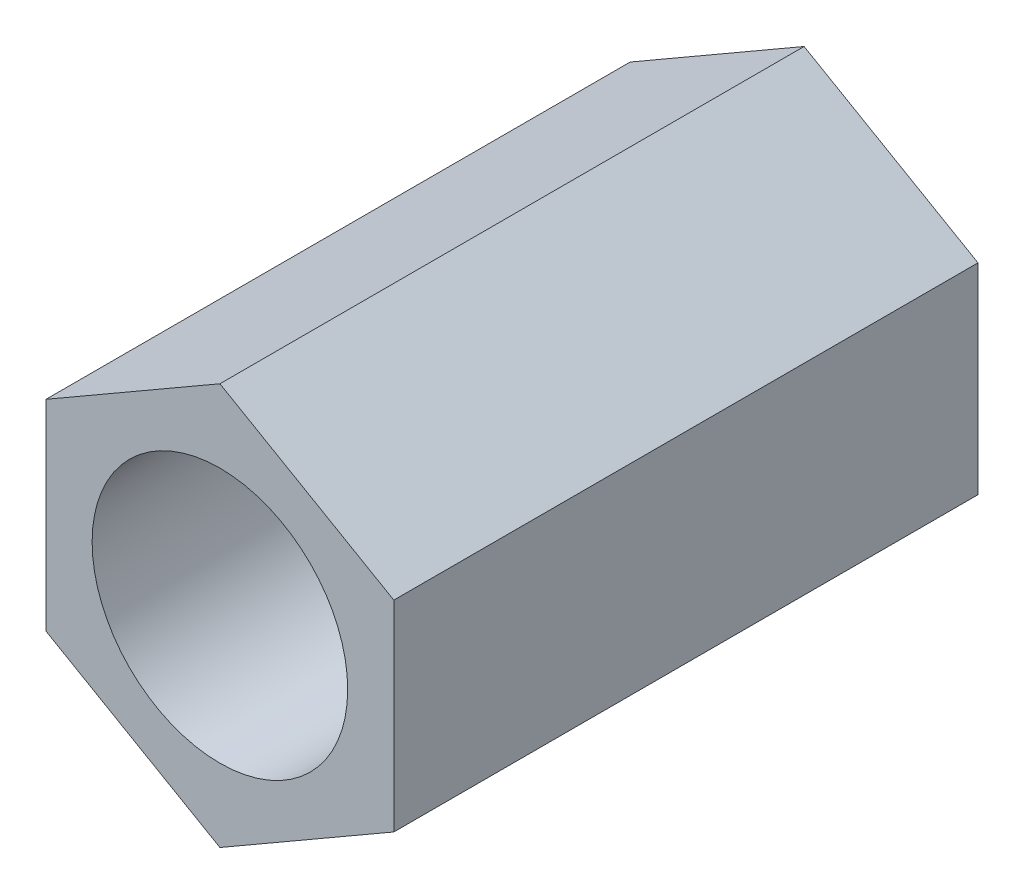
from build123d import *

# Parameters (mm, degrees)
BOSS_EXTRUDE1_DEPTH = 8
SKETCH2_R           = 1.75
CUT_EXTRUDE1_DEPTH  = 9.788308995


with BuildPart() as part:
    # Sketch1 → Boss-Extrude1 (new body)
    with BuildSketch(Plane.XY):
        Polygon((0, 2.75), (-2.38156986, 1.375), (-2.38156986, -1.375), (0, -2.75), (2.38156986, -1.375), (2.38156986, 1.375), align=None)
    extrude(amount=BOSS_EXTRUDE1_DEPTH)

    # Sketch2 → Cut-Extrude1 (cut, through all)
    with BuildSketch(Plane.XY.offset(8)):
        Circle(SKETCH2_R)
    extrude(amount=-CUT_EXTRUDE1_DEPTH, mode=Mode.SUBTRACT)


solid = part.part
